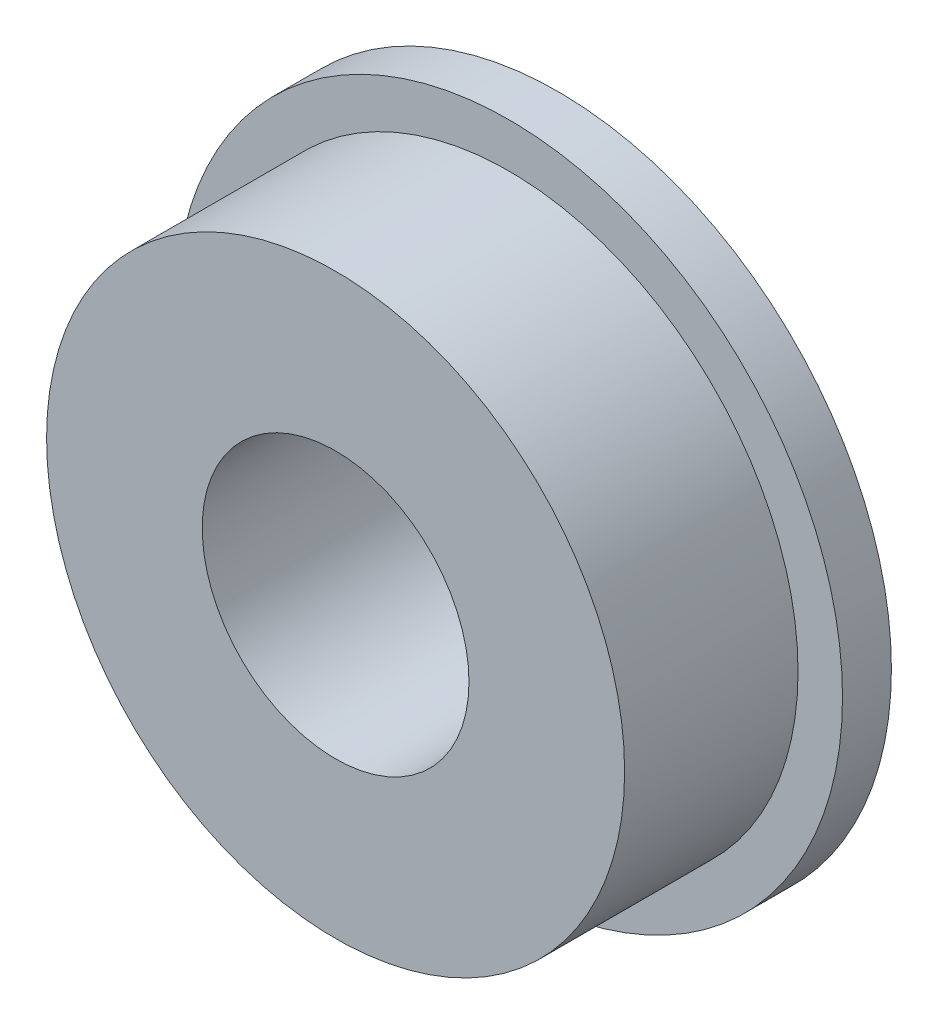
from build123d import *


with BuildPart() as part:
    # 草图1 → 旋转1 (revolve)
    with BuildSketch(Plane(origin=(0, 0, 0), x_dir=(1, 0, 0), z_dir=(0, 1, 0))):
        Polygon((3, 0), (6.5, 0), (6.5, 3.9), (7.5, 3.9), (7.5, 5), (3, 5), align=None)
    revolve(axis=Axis((0, 0, 0), (0, 0, -1)))


solid = part.part
